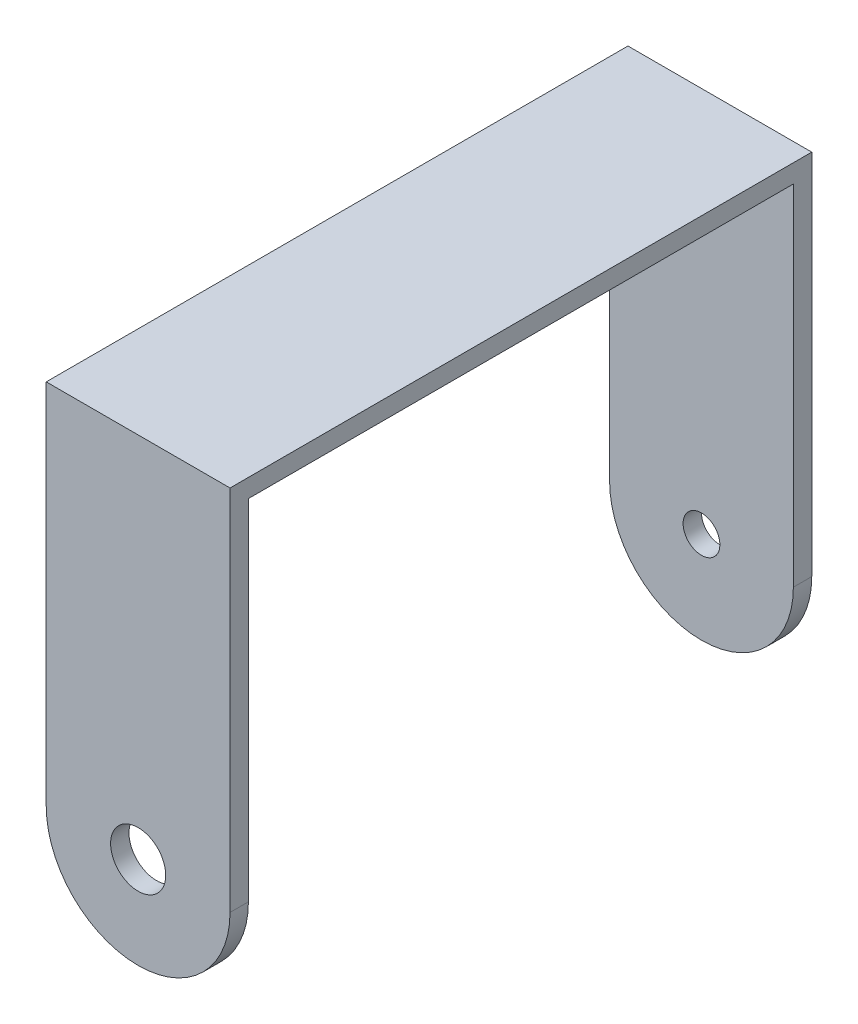
from build123d import *

# Parameters (mm, degrees)
EXTRUDE_1_DEPTH     = 2
SKETCH_2_W          = 20
SKETCH_2_H          = 2
EXTRUDE_2_DEPTH     = 61.3
CUT_EXTRUDE_1_REACH = 79.504
SKETCH_4_R          = 3
SKETCH_6_R          = 2
CUT_EXTRUDE_2_DEPTH = 2


with BuildPart() as part:
    # 草图1 → 凸台-拉伸1 (new body)
    with BuildSketch(Plane.XY):
        with BuildLine():
            Line((0, 0), (0, 40))
            Line((0, 40), (20, 40))
            Line((20, 40), (20, 0))
            ThreePointArc((20, 0), (10, -10), (0, 0))
        make_face()
    extrude_1 = extrude(amount=EXTRUDE_1_DEPTH)

    # 草图2 → 凸台-拉伸2 (add)
    with BuildSketch(Plane.XY.offset(2)):
        with Locations((10, 39)):
            Rectangle(SKETCH_2_W, SKETCH_2_H)
    extrude(amount=EXTRUDE_2_DEPTH)

    # 镜向1: 凸台-拉伸1 across plane
    add(extrude_1.mirror(Plane.XY.offset(31.65)))

    # 草图4 → 切除-拉伸1 (cut, up to next)
    with BuildSketch(Plane.XY.offset(63.3), mode=Mode.PRIVATE) as cut_extrude_1_sk1:
        with Locations((10, 0)):
            Circle(SKETCH_4_R)
    cut_extrude_1_tool1 = extrude(cut_extrude_1_sk1.sketch, amount=-CUT_EXTRUDE_1_REACH, mode=Mode.PRIVATE) & part.part
    add(cut_extrude_1_tool1.solids().sort_by_distance((10, 0, 63.3))[0], mode=Mode.SUBTRACT)

    # 草图6 → 切除-拉伸2 (cut)
    with BuildSketch(Plane.XY.offset(2)):
        with Locations((10, 0)):
            Circle(SKETCH_6_R)
    extrude(amount=-CUT_EXTRUDE_2_DEPTH, mode=Mode.SUBTRACT)


solid = part.part
